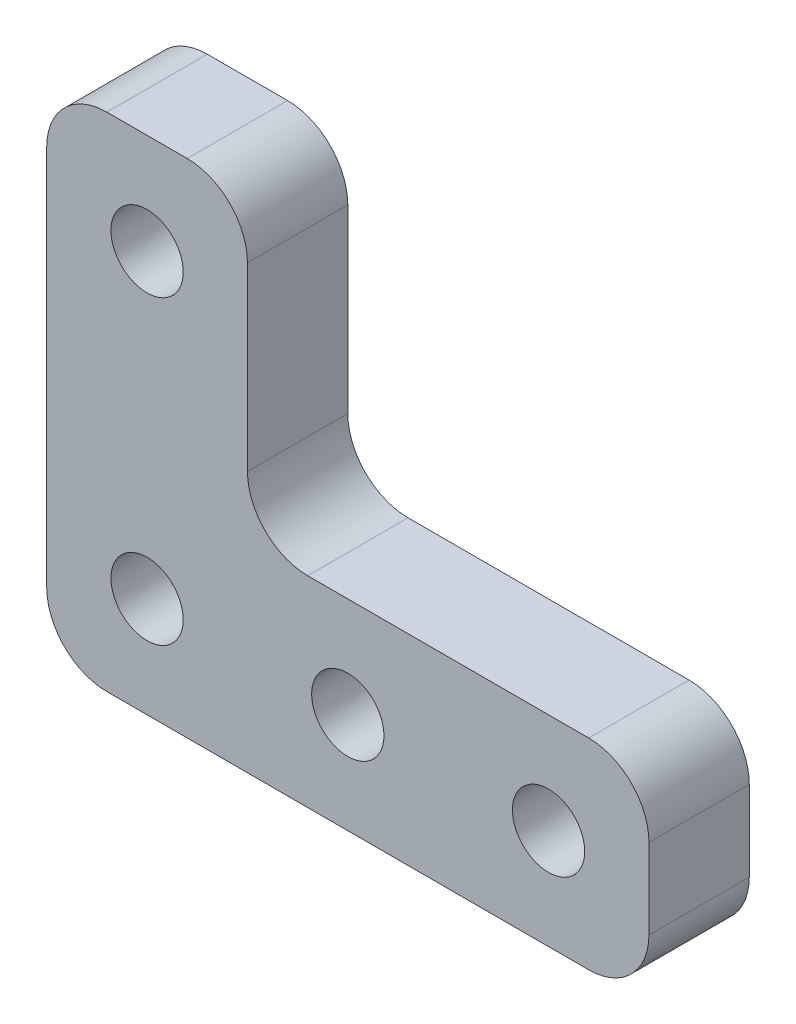
from build123d import *

# Parameters (mm, degrees)
SKETCH1_R           = 2.286
BOSS_EXTRUDE1_DEPTH = 6.35
FILLET1_R           = 3.81


with BuildPart() as part:
    # Sketch1 → Boss-Extrude1 (new body)
    with BuildSketch(Plane.XY):
        Polygon((-6.35, -6.35), (-6.35, 25.4), (6.35, 25.4), (6.35, 6.35), (31.75, 6.35), (31.75, -6.35), align=None)
        Circle(SKETCH1_R, mode=Mode.SUBTRACT)
        with Locations((12.7, 0)):
            Circle(SKETCH1_R, mode=Mode.SUBTRACT)
        with Locations((25.4, 0)):
            Circle(SKETCH1_R, mode=Mode.SUBTRACT)
        with Locations((0, 19.05)):
            Circle(SKETCH1_R, mode=Mode.SUBTRACT)
    extrude(amount=BOSS_EXTRUDE1_DEPTH)

    # Fillet1
    fillet1_edges = [part.edges().sort_by_distance(p)[0] for p in [
        (-6.35, -6.35, 3.175),
        (-6.35, 25.4, 3.175),
        (6.35, 25.4, 3.175),
        (6.35, 6.35, 3.175),
        (31.75, 6.35, 3.175),
        (31.75, -6.35, 3.175),
    ]]
    fillet(fillet1_edges, radius=FILLET1_R)


solid = part.part
